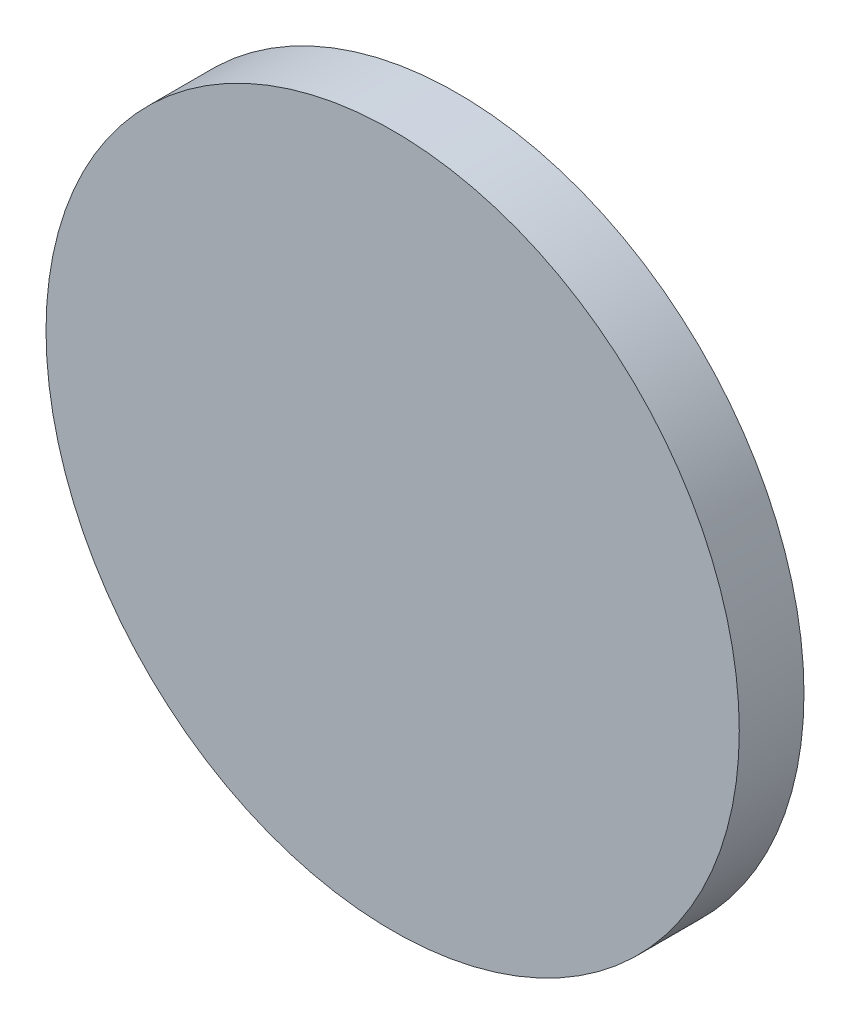
from build123d import *

# Parameters (mm, degrees)
SKETCH1_R           = 37.5
BOSS_EXTRUDE1_DEPTH = 7


with BuildPart() as part:
    # Sketch1 → Boss-Extrude1 (new body)
    with BuildSketch(Plane.XY):
        Circle(SKETCH1_R)
    extrude(amount=BOSS_EXTRUDE1_DEPTH)


solid = part.part
